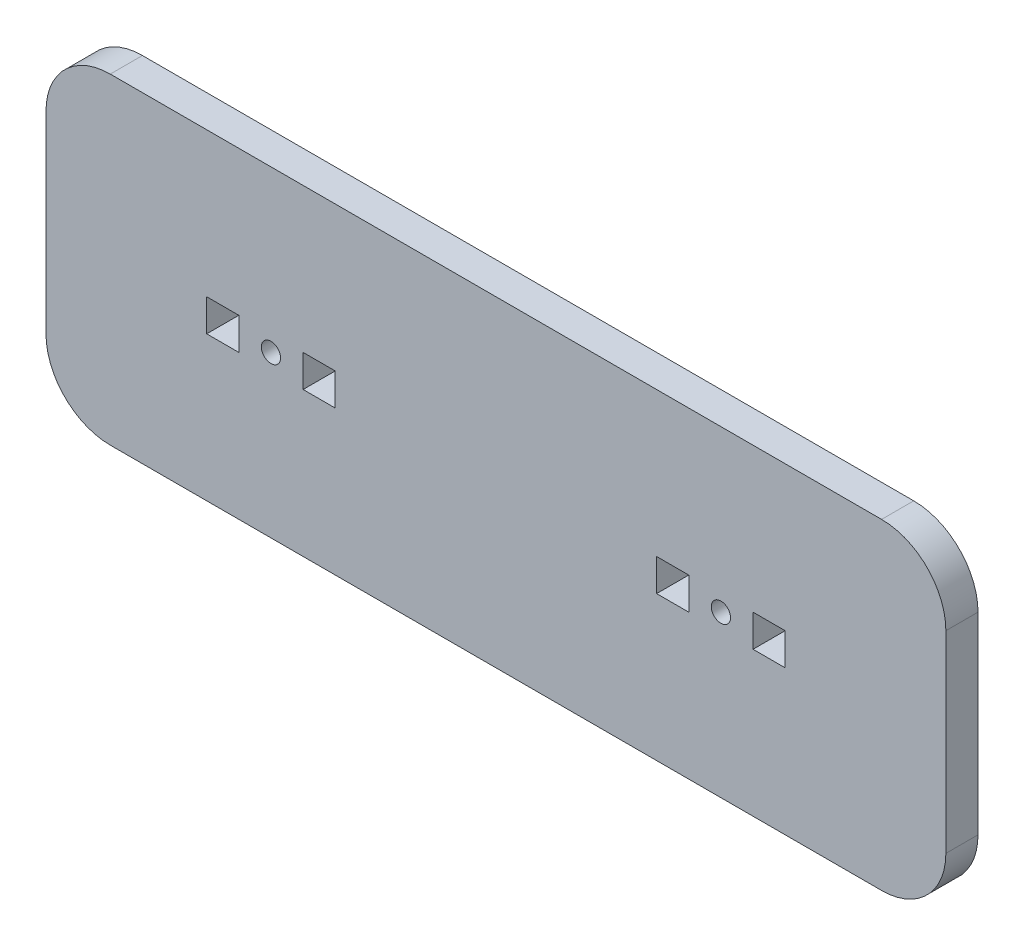
from build123d import *

# Parameters (mm, degrees)
SKETCH1_W           = 140
SKETCH1_H           = 50
SKETCH1_R           = 1.5
SKETCH1_W_2         = 5
SKETCH1_H_2         = 5
BOSS_EXTRUDE1_DEPTH = 5
FILLET1_R           = 10


with BuildPart() as part:
    # Sketch1 → Boss-Extrude1 (new body)
    with BuildSketch(Plane.XY):
        Rectangle(SKETCH1_W, SKETCH1_H)
        with Locations((35, 0)):
            Circle(SKETCH1_R, mode=Mode.SUBTRACT)
        with Locations((-35, 0)):
            Circle(SKETCH1_R, mode=Mode.SUBTRACT)
        with Locations((27.5, 0)):
            Rectangle(SKETCH1_W_2, SKETCH1_H_2, mode=Mode.SUBTRACT)
        with Locations((42.5, 0)):
            Rectangle(SKETCH1_W_2, SKETCH1_H_2, mode=Mode.SUBTRACT)
        with Locations((-42.5, 0)):
            Rectangle(SKETCH1_W_2, SKETCH1_H_2, mode=Mode.SUBTRACT)
        with Locations((-27.5, 0)):
            Rectangle(SKETCH1_W_2, SKETCH1_H_2, mode=Mode.SUBTRACT)
    extrude(amount=BOSS_EXTRUDE1_DEPTH)

    # Fillet1
    fillet1_edges = [part.edges().sort_by_distance(p)[0] for p in [
        (70, -25, 2.5),
        (-70, -25, 2.5),
        (-70, 25, 2.5),
        (70, 25, 2.5),
    ]]
    fillet(fillet1_edges, radius=FILLET1_R)


solid = part.part
